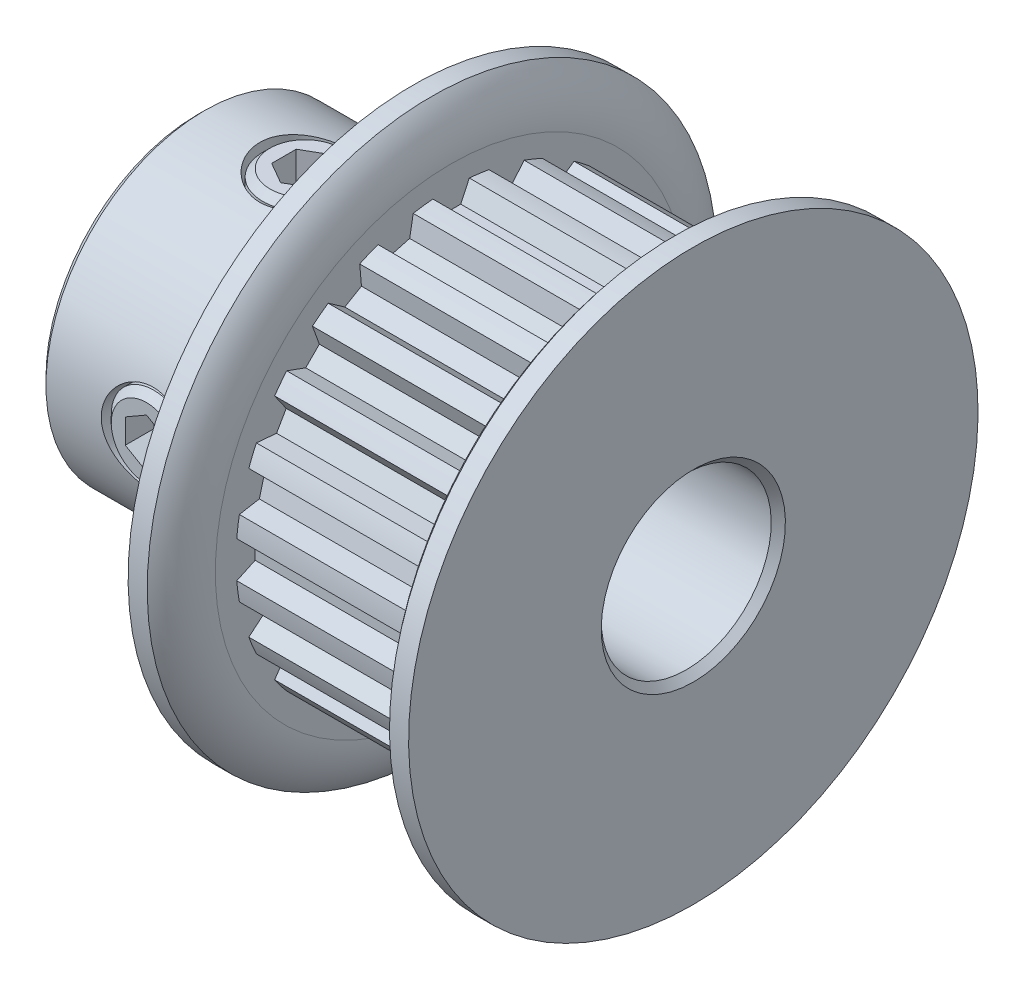
from build123d import *

# Parameters (mm, degrees)
SKETCH4_R          = 7.75
SKETCH4_R_2        = 7.59125
CUT_EXTRUDE2_DEPTH = 7.2
CUT_EXTRUDE1_DEPTH = 7.2
CIRPATTERN1_COUNT  = 24
SKETCH6_R          = 1.6
CUT_EXTRUDE3_DEPTH = 17.690341518
CUT_EXTRUDE4_DEPTH = 1.016
CIRPATTERN2_COUNT  = 2
CIRPATTERN2_ANGLE  = 90
CIRPATTERN3_COUNT  = 2
CIRPATTERN3_ANGLE  = 90
CHAMFER1_SIZE      = 0.25


with BuildPart() as part:
    # Sketch1 → Revolve1 (revolve)
    with BuildSketch(Plane.XY, mode=Mode.PRIVATE) as revolve1_sk:
        with BuildLine():
            Line((-8.75, 3), (8.75, 3))
            Line((8.75, 3), (8.75, 10.05))
            Line((8.75, 10.05), (8.075, 10.05))
            ThreePointArc((8.075, 10.05), (7.574735294, 9.249311572), (7.4, 8.3215))
            Line((7.4, 8.3215), (7.4, 7.75))
            Line((7.4, 7.75), (0.2, 7.75))
            Line((0.2, 7.75), (0.2, 8.3215))
            ThreePointArc((0.2, 8.3215), (0.025264706, 9.249311572), (-0.475, 10.05))
            Line((-0.475, 10.05), (-1.15, 10.05))
            Line((-1.15, 10.05), (-1.15, 5.6))
            Line((-1.15, 5.6), (-8.75, 5.6))
            Line((-8.75, 5.6), (-8.75, 3))
        make_face()
    revolve(revolve1_sk.sketch.rotate(Axis((-8.75, 0, 0), (1, 0, 0)), 180), axis=Axis((-8.75, 0, 0), (1, 0, 0)))

    # Sketch4 → Cut-Extrude2 (cut)
    with BuildSketch(Plane(origin=(0.2, 0, 0), x_dir=(0, 0, -1), z_dir=(1, 0, 0))):
        Circle(SKETCH4_R)
        with Locations(Location((0, 0, 0), (0, 0, 180))):
            Circle(SKETCH4_R_2, mode=Mode.SUBTRACT)
    extrude(amount=CUT_EXTRUDE2_DEPTH, mode=Mode.SUBTRACT)

    # Sketch3 → Cut-Extrude1 (cut)
    with BuildSketch(Plane(origin=(0.2, 0, 0), x_dir=(0, 0, -1), z_dir=(1, 0, 0))):
        with BuildLine():
            Line((-0.643063359, 7.563963649), (-0.340959829, 6.916100538))
            Line((-0.340959829, 6.916100538), (0.340959829, 6.916100538))
            Line((0.340959829, 6.916100538), (0.643063359, 7.563963649))
            ThreePointArc((0.643063359, 7.563963649), (0, 7.59125), (-0.643063359, 7.563963649))
        make_face()
    cut_extrude1 = extrude(amount=CUT_EXTRUDE1_DEPTH, mode=Mode.SUBTRACT)

    # CirPattern1: Cut-Extrude1 ×24 about axis
    cirpattern1_axis = Axis((0, 0, 0), (1, 0, 0))
    for i in range(1, CIRPATTERN1_COUNT):
        add(cut_extrude1.rotate(cirpattern1_axis, i * 360 / CIRPATTERN1_COUNT), mode=Mode.SUBTRACT)

    # Sketch6 → Cut-Extrude3 (cut, through all)
    with BuildSketch(Plane(origin=(0, 0, 0), x_dir=(1, 0, 0), z_dir=(0, 1, 0))):
        with Locations(Location((-4.95, 0, 0), (0, 0, 90))):
            Circle(SKETCH6_R)
    cut_extrude3 = extrude(amount=CUT_EXTRUDE3_DEPTH, mode=Mode.SUBTRACT)

    # CirPattern2: Cut-Extrude3 ×2 about axis
    cirpattern2_axis = Axis((-8.75, 0, 0), (1, 0, 0))
    for i in range(1, CIRPATTERN2_COUNT):
        add(cut_extrude3.rotate(cirpattern2_axis, i * CIRPATTERN2_ANGLE / (CIRPATTERN2_COUNT - 1)), mode=Mode.SUBTRACT)

    # Chamfer1
    chamfer1_edges = [part.edges().sort_by_distance(p)[0] for p in [
        (8.75, 3, 0),
        (-8.75, 3, 0),
        (-8.75, 5.6, 0),
    ]]
    chamfer(chamfer1_edges, length=CHAMFER1_SIZE)


with BuildPart() as body_2:
    # Sketch7 → Revolve2 (revolve)
    with BuildSketch(Plane.XY, mode=Mode.PRIVATE) as revolve2_sk:
        Polygon((-6.196, 5.6), (-4.95, 5.6), (-4.95, 3.381), (-6.196, 3.381), (-6.45, 3.635), (-6.45, 5.346), align=None)
    revolve(revolve2_sk.sketch.rotate(Axis((-4.95, 3.381, 0), (0, 1, 0)), 270), axis=Axis((-4.95, 3.381, 0), (0, 1, 0)))

    # Sketch8 → Cut-Extrude4 (cut)
    with BuildSketch(Plane(origin=(0, 5.6, 0), x_dir=(1, 0, 0), z_dir=(0, 1, 0))):
        Polygon((-4.95, 0.866025404), (-5.7, 0.433012702), (-5.7, -0.433012702), (-4.95, -0.866025404), (-4.2, -0.433012702), (-4.2, 0.433012702), align=None)
    extrude(amount=-CUT_EXTRUDE4_DEPTH, mode=Mode.SUBTRACT)


with BuildPart() as cirpattern3_1:
    # CirPattern3: pattern copy
    add(body_2.part.rotate(Axis((0, 0, 0), (1, 0, 0)), 1 * CIRPATTERN3_ANGLE / (CIRPATTERN3_COUNT - 1)))


solid = Compound([part.part, body_2.part, cirpattern3_1.part])
